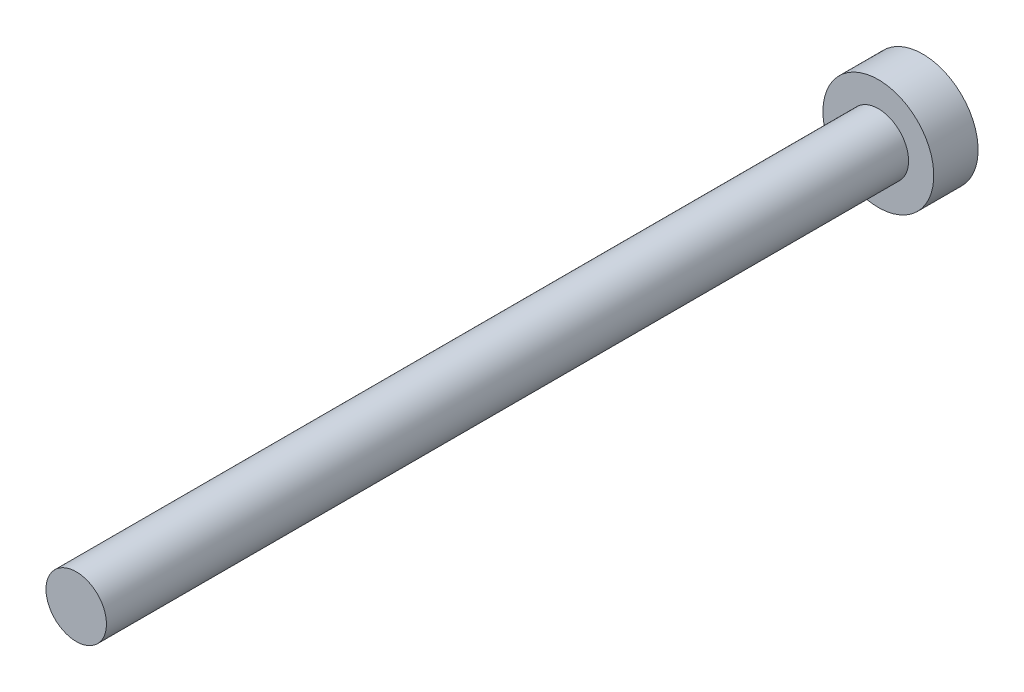
from build123d import *

# Parameters (mm, degrees)
SKETCH1_R           = 1.5
BOSS_EXTRUDE1_DEPTH = 42
SKETCH2_R           = 2.75
BOSS_EXTRUDE2_DEPTH = 2.2
ESCALA1_SCALE       = 1.5
ESCALA2_SCALE       = 1.5


with BuildPart() as part:
    # Sketch1 → Boss-Extrude1 (new body)
    with BuildSketch(Plane.XY):
        with Locations(Location((0, 0, 0), (0, 0, 180))):
            Circle(SKETCH1_R)
    extrude(amount=BOSS_EXTRUDE1_DEPTH)

    # Sketch2 → Boss-Extrude2 (add)
    with BuildSketch(Plane(origin=(0, 0, 0), x_dir=(-1, 0, 0), z_dir=(0, 0, -1))):
        Circle(SKETCH2_R)
    extrude(amount=-BOSS_EXTRUDE2_DEPTH)


with BuildPart() as part_1:
    # Escala1: scaled about (0, 0, 0)
    add(part.part.scale(ESCALA1_SCALE))


with BuildPart() as part_2:
    # Escala2: scaled about (0, 0, 0)
    add(part_1.part.scale(ESCALA2_SCALE))


solid = part_2.part
